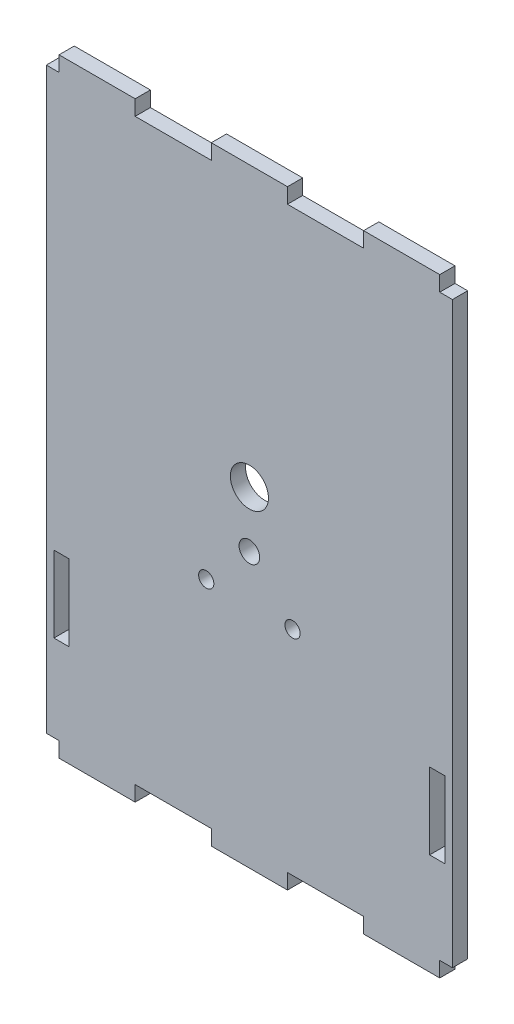
from build123d import *

# Parameters (mm, degrees)
SKETCH_1_W          = 3
SKETCH_1_H          = 15
EXTRUDE_1_DEPTH     = 3
SKETCH_2_R          = 1.5
SKETCH_2_R_2        = 2.03
SKETCH_2_R_3        = 3.75
CUT_EXTRUDE_1_DEPTH = 10


with BuildPart() as part:
    # 草图1 → 凸台-拉伸1 (new body)
    with BuildSketch(Plane.XY):
        Polygon((2.5, 3), (0, 3), (0, 117), (2.5, 117), (2.5, 120), (17.5, 120), (17.5, 117), (32.5, 117), (32.5, 120), (47.5, 120), (47.5, 117), (62.5, 117), (62.5, 120), (77.5, 120), (77.5, 117), (80, 117), (80, 3), (77.5, 3), (77.5, 0), (62.5, 0), (62.5, 3), (47.5, 3), (47.5, 0), (32.5, 0), (32.5, 3), (17.5, 3), (17.5, 0), (2.5, 0), align=None)
        with Locations((77, 27.5)):
            Rectangle(SKETCH_1_W, SKETCH_1_H, mode=Mode.SUBTRACT)
        with Locations((3, 27.5)):
            Rectangle(SKETCH_1_W, SKETCH_1_H, mode=Mode.SUBTRACT)
    extrude(amount=EXTRUDE_1_DEPTH)

    # 草图2 → 切除-拉伸1 (cut)
    with BuildSketch(Plane.XY.offset(3)):
        with Locations((31.5, 45)):
            Circle(SKETCH_2_R)
        with Locations((48.5, 45)):
            Circle(SKETCH_2_R)
        with Locations((40, 54)):
            Circle(SKETCH_2_R_2)
        with Locations((40, 65)):
            Circle(SKETCH_2_R_3)
    extrude(amount=-CUT_EXTRUDE_1_DEPTH, mode=Mode.SUBTRACT)


solid = part.part
